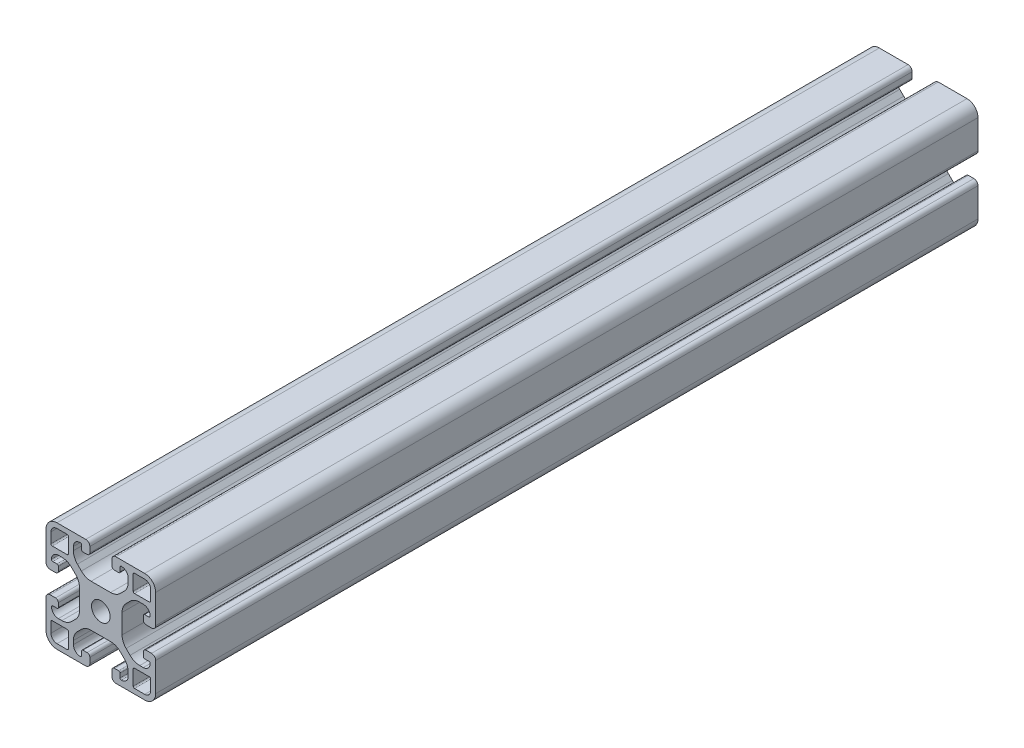
from build123d import *

# Parameters (mm, degrees)
SKETCH1_R           = 3.4
BOSS_EXTRUDE1_DEPTH = 300


with BuildPart() as part:
    # Sketch1 → Boss-Extrude1 (new body)
    with BuildSketch(Plane.XY):
        with BuildLine():
            Line((0, 36), (0, 25.5))
            ThreePointArc((0, 25.5), (0.439339828, 24.439339828), (1.5, 24))
            Line((1.5, 24), (3.5, 24))
            ThreePointArc((3.5, 24), (4.207106781, 24.292893219), (4.5, 25))
            Line((4.5, 25), (4.5, 26.5))
            ThreePointArc((4.5, 26.5), (4.353553391, 26.853553391), (4, 27))
            Line((4, 27), (2.5, 27))
            ThreePointArc((2.5, 27), (2.146446609, 27.146446609), (2, 27.5))
            ThreePointArc((2, 27.5), (2.732233047, 29.267766953), (4.5, 30))
            Line((4.5, 30), (5.807611845, 30))
            ThreePointArc((5.807611845, 30), (7.721029006, 29.619397663), (9.343145751, 28.535533906))
            Line((9.343145751, 28.535533906), (10.785533906, 27.093145751))
            ThreePointArc((10.785533906, 27.093145751), (11.869397663, 25.471029006), (12.25, 23.557611845))
            Line((12.25, 23.557611845), (12.25, 16.442388155))
            ThreePointArc((12.25, 16.442388155), (11.869397663, 14.528970994), (10.785533906, 12.906854249))
            Line((10.785533906, 12.906854249), (9.343145751, 11.464466094))
            ThreePointArc((9.343145751, 11.464466094), (7.721029006, 10.380602337), (5.807611845, 10))
            Line((5.807611845, 10), (4.5, 10))
            ThreePointArc((4.5, 10), (2.732233047, 10.732233047), (2, 12.5))
            ThreePointArc((2, 12.5), (2.146446609, 12.853553391), (2.5, 13))
            Line((2.5, 13), (4, 13))
            ThreePointArc((4, 13), (4.353553391, 13.146446609), (4.5, 13.5))
            Line((4.5, 13.5), (4.5, 15))
            ThreePointArc((4.5, 15), (4.207106781, 15.707106781), (3.5, 16))
            Line((3.5, 16), (1.5, 16))
            ThreePointArc((1.5, 16), (0.439339828, 15.560660172), (0, 14.5))
            Line((0, 14.5), (0, 4))
            ThreePointArc((0, 4), (1.171572875, 1.171572875), (4, 0))
            Line((4, 0), (14.5, 0))
            ThreePointArc((14.5, 0), (15.560660172, 0.439339828), (16, 1.5))
            Line((16, 1.5), (16, 3.5))
            ThreePointArc((16, 3.5), (15.707106781, 4.207106781), (15, 4.5))
            Line((15, 4.5), (13.5, 4.5))
            ThreePointArc((13.5, 4.5), (13.146446609, 4.353553391), (13, 4))
            Line((13, 4), (13, 2.5))
            ThreePointArc((13, 2.5), (12.853553391, 2.146446609), (12.5, 2))
            ThreePointArc((12.5, 2), (10.732233047, 2.732233047), (10, 4.5))
            Line((10, 4.5), (10, 5.807611845))
            ThreePointArc((10, 5.807611845), (10.380602337, 7.721029006), (11.464466094, 9.343145751))
            Line((11.464466094, 9.343145751), (12.906854249, 10.785533906))
            ThreePointArc((12.906854249, 10.785533906), (14.528970994, 11.869397663), (16.442388155, 12.25))
            Line((16.442388155, 12.25), (23.557611845, 12.25))
            ThreePointArc((23.557611845, 12.25), (25.471029006, 11.869397663), (27.093145751, 10.785533906))
            Line((27.093145751, 10.785533906), (28.535533906, 9.343145751))
            ThreePointArc((28.535533906, 9.343145751), (29.619397663, 7.721029006), (30, 5.807611845))
            Line((30, 5.807611845), (30, 4.5))
            ThreePointArc((30, 4.5), (29.267766953, 2.732233047), (27.5, 2))
            ThreePointArc((27.5, 2), (27.146446609, 2.146446609), (27, 2.5))
            Line((27, 2.5), (27, 4))
            ThreePointArc((27, 4), (26.853553391, 4.353553391), (26.5, 4.5))
            Line((26.5, 4.5), (25, 4.5))
            ThreePointArc((25, 4.5), (24.292893219, 4.207106781), (24, 3.5))
            Line((24, 3.5), (24, 1.5))
            ThreePointArc((24, 1.5), (24.439339828, 0.439339828), (25.5, 0))
            Line((25.5, 0), (36, 0))
            ThreePointArc((36, 0), (38.828427125, 1.171572875), (40, 4))
            Line((40, 4), (40, 14.5))
            ThreePointArc((40, 14.5), (39.560660172, 15.560660172), (38.5, 16))
            Line((38.5, 16), (36.5, 16))
            ThreePointArc((36.5, 16), (35.792893219, 15.707106781), (35.5, 15))
            Line((35.5, 15), (35.5, 13.5))
            ThreePointArc((35.5, 13.5), (35.646446609, 13.146446609), (36, 13))
            Line((36, 13), (37.5, 13))
            ThreePointArc((37.5, 13), (37.853553391, 12.853553391), (38, 12.5))
            ThreePointArc((38, 12.5), (37.267766953, 10.732233047), (35.5, 10))
            Line((35.5, 10), (34.192388155, 10))
            ThreePointArc((34.192388155, 10), (32.278970994, 10.380602337), (30.656854249, 11.464466094))
            Line((30.656854249, 11.464466094), (29.214466094, 12.906854249))
            ThreePointArc((29.214466094, 12.906854249), (28.130602337, 14.528970994), (27.75, 16.442388155))
            Line((27.75, 16.442388155), (27.75, 23.557611845))
            ThreePointArc((27.75, 23.557611845), (28.130602337, 25.471029006), (29.214466094, 27.093145751))
            Line((29.214466094, 27.093145751), (30.656854249, 28.535533906))
            ThreePointArc((30.656854249, 28.535533906), (32.278970994, 29.619397663), (34.192388155, 30))
            Line((34.192388155, 30), (35.5, 30))
            ThreePointArc((35.5, 30), (37.267766953, 29.267766953), (38, 27.5))
            ThreePointArc((38, 27.5), (37.853553391, 27.146446609), (37.5, 27))
            Line((37.5, 27), (36, 27))
            ThreePointArc((36, 27), (35.646446609, 26.853553391), (35.5, 26.5))
            Line((35.5, 26.5), (35.5, 25))
            ThreePointArc((35.5, 25), (35.792893219, 24.292893219), (36.5, 24))
            Line((36.5, 24), (38.5, 24))
            ThreePointArc((38.5, 24), (39.560660172, 24.439339828), (40, 25.5))
            Line((40, 25.5), (40, 36))
            ThreePointArc((40, 36), (38.828427125, 38.828427125), (36, 40))
            Line((36, 40), (25.5, 40))
            ThreePointArc((25.5, 40), (24.439339828, 39.560660172), (24, 38.5))
            Line((24, 38.5), (24, 36.5))
            ThreePointArc((24, 36.5), (24.292893219, 35.792893219), (25, 35.5))
            Line((25, 35.5), (26.5, 35.5))
            ThreePointArc((26.5, 35.5), (26.853553391, 35.646446609), (27, 36))
            Line((27, 36), (27, 37.5))
            ThreePointArc((27, 37.5), (27.146446609, 37.853553391), (27.5, 38))
            ThreePointArc((27.5, 38), (29.267766953, 37.267766953), (30, 35.5))
            Line((30, 35.5), (30, 34.192388155))
            ThreePointArc((30, 34.192388155), (29.619397663, 32.278970994), (28.535533906, 30.656854249))
            Line((28.535533906, 30.656854249), (27.093145751, 29.214466094))
            ThreePointArc((27.093145751, 29.214466094), (25.471029006, 28.130602337), (23.557611845, 27.75))
            Line((23.557611845, 27.75), (16.442388155, 27.75))
            ThreePointArc((16.442388155, 27.75), (14.528970994, 28.130602337), (12.906854249, 29.214466094))
            Line((12.906854249, 29.214466094), (11.464466094, 30.656854249))
            ThreePointArc((11.464466094, 30.656854249), (10.380602337, 32.278970994), (10, 34.192388155))
            Line((10, 34.192388155), (10, 35.5))
            ThreePointArc((10, 35.5), (10.732233047, 37.267766953), (12.5, 38))
            ThreePointArc((12.5, 38), (12.853553391, 37.853553391), (13, 37.5))
            Line((13, 37.5), (13, 36))
            ThreePointArc((13, 36), (13.146446609, 35.646446609), (13.5, 35.5))
            Line((13.5, 35.5), (15, 35.5))
            ThreePointArc((15, 35.5), (15.707106781, 35.792893219), (16, 36.5))
            Line((16, 36.5), (16, 38.5))
            ThreePointArc((16, 38.5), (15.560660172, 39.560660172), (14.5, 40))
            Line((14.5, 40), (4, 40))
            ThreePointArc((4, 40), (1.171572875, 38.828427125), (0, 36))
        make_face()
        with Locations(Location((20, 20, 0), (0, 0, 180))):
            Circle(SKETCH1_R, mode=Mode.SUBTRACT)
        with BuildLine():
            Line((1.8, 4), (1.8, 7.7))
            ThreePointArc((1.8, 7.7), (1.946446609, 8.053553391), (2.3, 8.2))
            Line((2.3, 8.2), (7.7, 8.2))
            ThreePointArc((7.7, 8.2), (8.053553391, 8.053553391), (8.2, 7.7))
            Line((8.2, 7.7), (8.2, 2.3))
            ThreePointArc((8.2, 2.3), (8.053553391, 1.946446609), (7.7, 1.8))
            Line((7.7, 1.8), (4, 1.8))
            ThreePointArc((4, 1.8), (2.444365081, 2.444365081), (1.8, 4))
        make_face(mode=Mode.SUBTRACT)
        with BuildLine():
            Line((4, 38.2), (7.7, 38.2))
            ThreePointArc((7.7, 38.2), (8.053553391, 38.053553391), (8.2, 37.7))
            Line((8.2, 37.7), (8.2, 32.3))
            ThreePointArc((8.2, 32.3), (8.053553391, 31.946446609), (7.7, 31.8))
            Line((7.7, 31.8), (2.3, 31.8))
            ThreePointArc((2.3, 31.8), (1.946446609, 31.946446609), (1.8, 32.3))
            Line((1.8, 32.3), (1.8, 36))
            ThreePointArc((1.8, 36), (2.444365081, 37.555634919), (4, 38.2))
        make_face(mode=Mode.SUBTRACT)
        with BuildLine():
            Line((31.8, 32.3), (31.8, 37.7))
            ThreePointArc((31.8, 37.7), (31.946446609, 38.053553391), (32.3, 38.2))
            Line((32.3, 38.2), (36, 38.2))
            ThreePointArc((36, 38.2), (37.555634919, 37.555634919), (38.2, 36))
            Line((38.2, 36), (38.2, 32.3))
            ThreePointArc((38.2, 32.3), (38.053553391, 31.946446609), (37.7, 31.8))
            Line((37.7, 31.8), (32.3, 31.8))
            ThreePointArc((32.3, 31.8), (31.946446609, 31.946446609), (31.8, 32.3))
        make_face(mode=Mode.SUBTRACT)
        with BuildLine():
            Line((32.3, 8.2), (37.7, 8.2))
            ThreePointArc((37.7, 8.2), (38.053553391, 8.053553391), (38.2, 7.7))
            Line((38.2, 7.7), (38.2, 4))
            ThreePointArc((38.2, 4), (37.555634919, 2.444365081), (36, 1.8))
            Line((36, 1.8), (32.3, 1.8))
            ThreePointArc((32.3, 1.8), (31.946446609, 1.946446609), (31.8, 2.3))
            Line((31.8, 2.3), (31.8, 7.7))
            ThreePointArc((31.8, 7.7), (31.946446609, 8.053553391), (32.3, 8.2))
        make_face(mode=Mode.SUBTRACT)
    extrude(amount=-BOSS_EXTRUDE1_DEPTH)


solid = part.part
